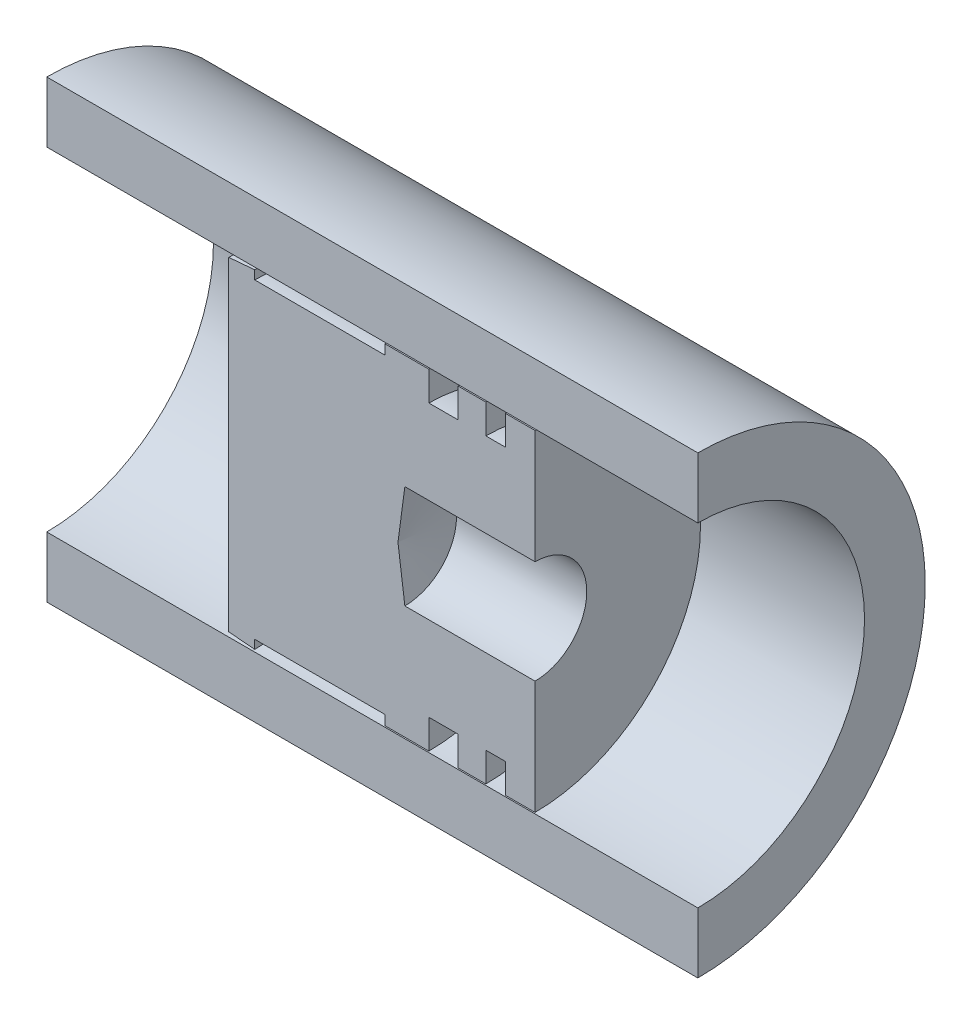
from build123d import *

# Parameters (mm, degrees)
SKETCH3_W          = 100
SKETCH3_H          = 9.325
SKETCH4_W          = 119
SKETCH4_H          = 90
CUT_EXTRUDE1_DEPTH = 90.802623848
SKETCH5_W          = 115
SKETCH5_H          = 80
CUT_EXTRUDE2_DEPTH = 90.802623848


with BuildPart() as part:
    # Sketch1 → Revolve1 (revolve)
    with BuildSketch(Plane.XY, mode=Mode.PRIVATE) as revolve1_sk:
        Polygon((-43.06, 25.25), (-47.06, 24.9), (-47.06, 0), (-21.06, 0), (-20, 7.9375), (0, 7.9375), (0, 25.4), (-4.56, 25.4), (-4.56, 20.9), (-7.56, 20.9), (-7.56, 25.4), (-11.81, 25.4), (-11.81, 20.9), (-16.31, 20.9), (-16.31, 25.4), (-23.06, 25.4), (-23.06, 23.9), (-43.06, 23.9), align=None)
    revolve(revolve1_sk.sketch.rotate(Axis((-47.06, 0, 0), (1, 0, 0)), 90), axis=Axis((-47.06, 0, 0), (1, 0, 0)))

    # Sketch4 → Cut-Extrude1 (cut, through all)
    with BuildSketch(Plane.XY):
        with Locations((-24.5, 0)):
            Rectangle(SKETCH4_W, SKETCH4_H)
    extrude(amount=CUT_EXTRUDE1_DEPTH, mode=Mode.SUBTRACT)


with BuildPart() as body_2:
    # Sketch3 → Revolve2 (revolve)
    with BuildSketch(Plane.XY, mode=Mode.PRIVATE) as revolve2_sk:
        with Locations((-25, 30.2625)):
            Rectangle(SKETCH3_W, SKETCH3_H)
    revolve(revolve2_sk.sketch.rotate(Axis((-80, 0, 0), (1, 0, 0)), 90), axis=Axis((-80, 0, 0), (1, 0, 0)))

    # Sketch5 → Cut-Extrude2 (cut, through all)
    with BuildSketch(Plane.XY):
        with Locations((-27.5, 0)):
            Rectangle(SKETCH5_W, SKETCH5_H)
    extrude(amount=CUT_EXTRUDE2_DEPTH, mode=Mode.SUBTRACT)


solid = Compound([part.part, body_2.part])
